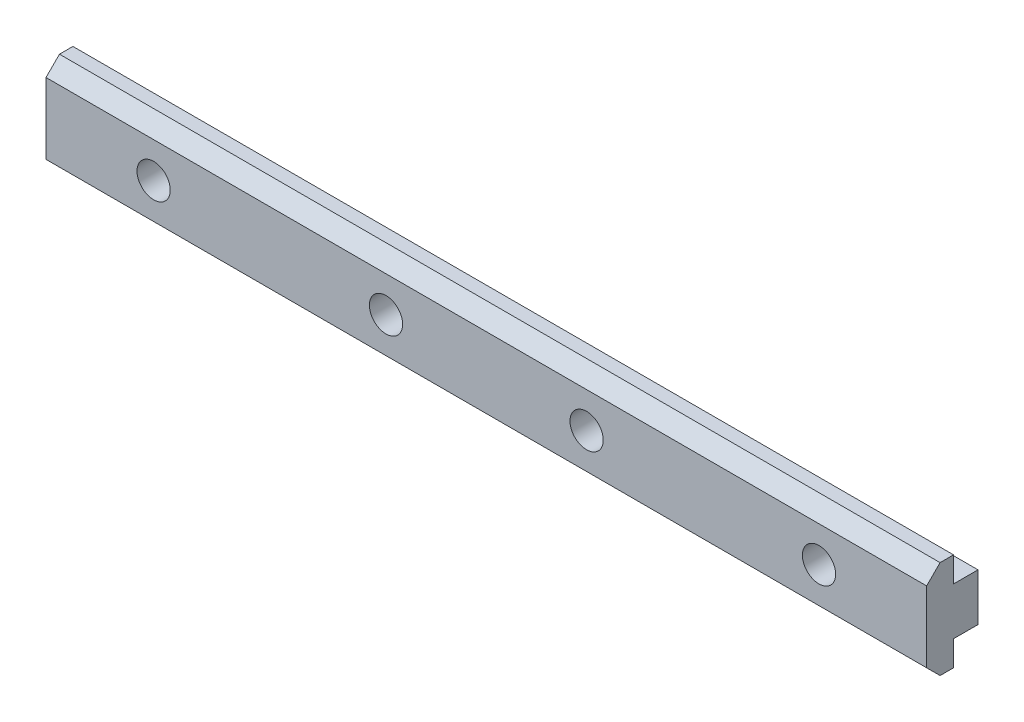
from build123d import *

# Parameters (mm, degrees)
EXTRUDE_1_DEPTH        = 90
HOLE_WIZARD_M8_1_D     = 6.8
HOLE_WIZARD_M8_1_DEPTH = 33.75
HOLE_WIZARD_M8_1_TIP   = 2.042926105


with BuildPart() as part:
    # 草图1 → 凸台-拉伸1 (new, symmetric)
    with BuildSketch(Plane(origin=(0, 0, 0), x_dir=(0, 0, -1), z_dir=(1, 0, 0))):
        Polygon((-10.5, -2.4), (-10.5, 12.1), (-7.75, 14.85), (-5, 14.85), (-5, 9.7), (0, 9.7), (0, 0), (-5, 0), (-5, -5.15), (-7.75, -5.15), align=None)
    extrude(amount=EXTRUDE_1_DEPTH, both=True)

    # M8 螺纹孔1
    with Locations(Plane(origin=(68, 4.85, 0), x_dir=(-1, 0, 0), z_dir=(0, 0, -1))):
        with Locations((0, 0), (47.5, 0), (88.5, 0), (136, 0)):
            Hole(HOLE_WIZARD_M8_1_D / 2, depth=HOLE_WIZARD_M8_1_DEPTH)
            with Locations((0, 0, -(HOLE_WIZARD_M8_1_DEPTH + HOLE_WIZARD_M8_1_TIP / 2))):  # 118° drill point
                Cone(0, HOLE_WIZARD_M8_1_D / 2, HOLE_WIZARD_M8_1_TIP, mode=Mode.SUBTRACT)


solid = part.part
